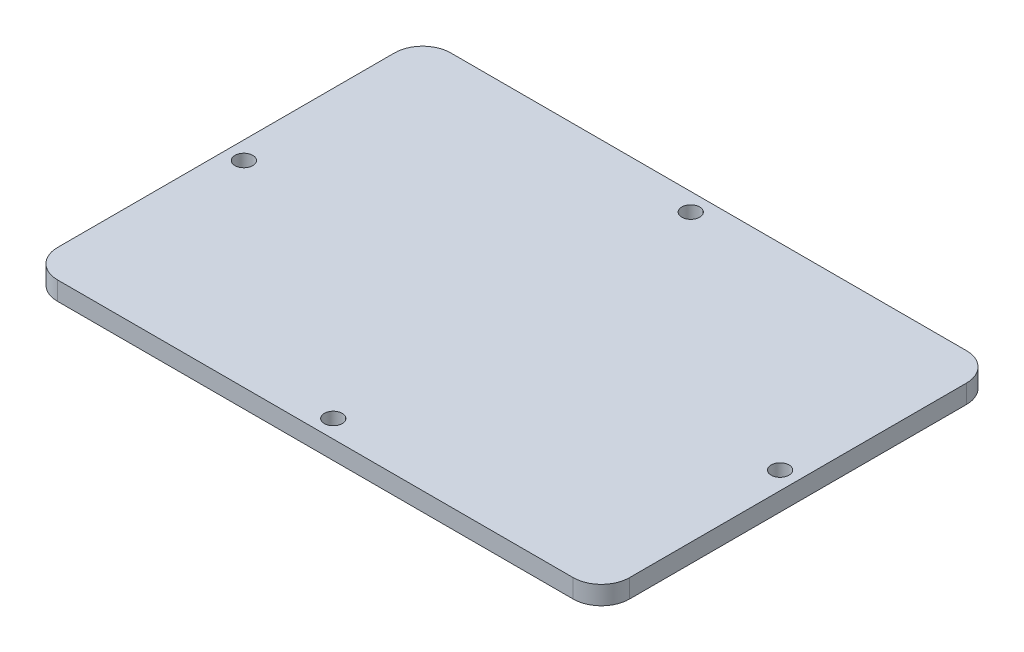
from build123d import *

# Parameters (mm, degrees)
SKETCH1_W           = 101.6
SKETCH1_H           = 69.85
BOSS_EXTRUDE1_DEPTH = 3.302
SKETCH4_R           = 1.5875
CUT_EXTRUDE1_DEPTH  = 62.735717611
FILLET1_R           = 5


with BuildPart() as part:
    # Sketch1 → Boss-Extrude1 (new body)
    with BuildSketch(Plane(origin=(0, 0, 0), x_dir=(1, 0, 0), z_dir=(0, 1, 0))):
        Rectangle(SKETCH1_W, SKETCH1_H)
    extrude(amount=BOSS_EXTRUDE1_DEPTH)

    # Sketch4 → Cut-Extrude1 (cut, through all)
    with BuildSketch(Plane(origin=(0, 0, 0), x_dir=(-1, 0, 0), z_dir=(0, -1, 0))):
        with Locations(Location((0, 31.75, 0), (0, 0, 90))):
            Circle(SKETCH4_R)
        with Locations(Location((-47.625, 0, 0), (0, 0, 90))):
            Circle(SKETCH4_R)
        with Locations(Location((0, -31.75, 0), (0, 0, 90))):
            Circle(SKETCH4_R)
        with Locations(Location((47.625, 0, 0), (0, 0, 90))):
            Circle(SKETCH4_R)
    extrude(amount=-CUT_EXTRUDE1_DEPTH, mode=Mode.SUBTRACT)

    # Fillet1
    fillet1_edges = [part.edges().sort_by_distance(p)[0] for p in [
        (50.8, 1.651, 34.925),
        (-50.8, 1.651, 34.925),
        (-50.8, 1.651, -34.925),
        (50.8, 1.651, -34.925),
    ]]
    fillet(fillet1_edges, radius=FILLET1_R)


solid = part.part
